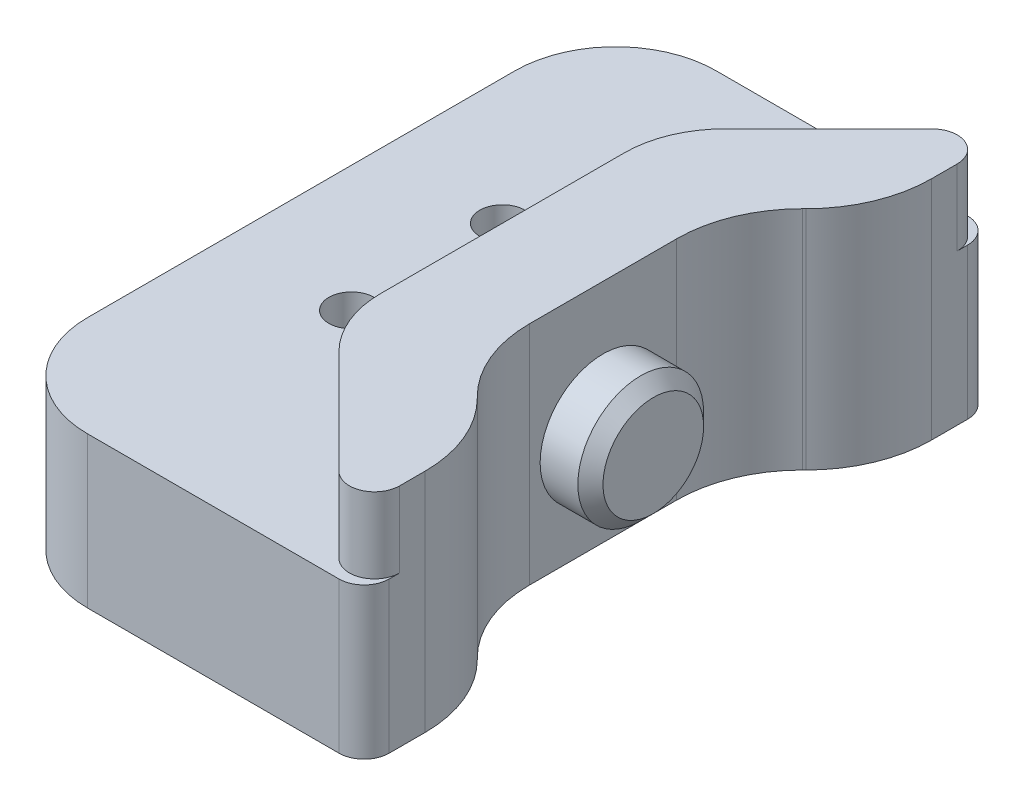
from build123d import *

# Parameters (mm, degrees)
SKETCH_1_R      = 0.9
EXTRUDE_1_DEPTH = 6
EXTRUDE_2_DEPTH = 3
FILLET_2_R      = 4
FILLET_3_R      = 1
SKETCH_3_R      = 2.5
EXTRUDE_3_DEPTH = 2
FILLET_4_R      = 5
CHAMFER_1_SIZE  = 0.5


with BuildPart() as part:
    # 草图1 → 凸台-拉伸1 (new body)
    with BuildSketch(Plane(origin=(0, 0, 0), x_dir=(1, 0, 0), z_dir=(0, 1, 0))):
        Polygon((0, 12.5), (0, -12.5), (15, -12.5), (15, -8), (12, -5), (12, 5), (15, 8), (15, 12.5), align=None)
        with Locations(Location((5, 3, 0), (0, 0, 270))):
            Circle(SKETCH_1_R, mode=Mode.SUBTRACT)
        with Locations(Location((5, -3, 0), (0, 0, 270))):
            Circle(SKETCH_1_R, mode=Mode.SUBTRACT)
    extrude(amount=EXTRUDE_1_DEPTH)

    # 草图2 → 凸台-拉伸2 (add)
    with BuildSketch(Plane(origin=(0, 6, 0), x_dir=(1, 0, 0), z_dir=(0, 1, 0))):
        with BuildLine():
            Line((13.292893219, 11.792893219), (8, 6.5))
            Line((8, 6.5), (8, -6.5))
            Line((8, -6.5), (13.292893219, -11.792893219))
            ThreePointArc((13.292893219, -11.792893219), (14.382683432, -12.00966597), (15, -11.085786438))
            Line((15, -11.085786438), (15, -8))
            Line((15, -8), (12, -5))
            Line((12, -5), (12, 5))
            Line((12, 5), (15, 8))
            Line((15, 8), (15, 11.085786438))
            ThreePointArc((15, 11.085786438), (14.382683432, 12.00966597), (13.292893219, 11.792893219))
        make_face()
    extrude(amount=EXTRUDE_2_DEPTH)

    # 圆角2
    fillet_2_edges = [part.edges().sort_by_distance(p)[0] for p in [
        (0, 3, 12.5),
        (0, 3, -12.5),
        (8, 7.5, -6.5),
        (8, 7.5, 6.5),
    ]]
    fillet(fillet_2_edges, radius=FILLET_2_R)

    # 圆角3
    fillet_3_edges = [part.edges().sort_by_distance(p)[0] for p in [
        (15, 3, -12.5),
        (15, 3, 12.5),
    ]]
    fillet(fillet_3_edges, radius=FILLET_3_R)

    # 草图3 → 凸台-拉伸3 (add)
    with BuildSketch(Plane(origin=(12, 0, 0), x_dir=(0, 0, -1), z_dir=(1, 0, 0))):
        with Locations(Location((0, 4, 0), (0, 0, 180))):
            Circle(SKETCH_3_R)
    extrude(amount=EXTRUDE_3_DEPTH)

    # 圆角4
    fillet_4_edges = [part.edges().sort_by_distance(p)[0] for p in [
        (15, 4.5, -8),
        (12, 4.5, -5),
        (12, 4.5, 5),
        (15, 4.5, 8),
    ]]
    fillet(fillet_4_edges, radius=FILLET_4_R)

    # 倒角1
    chamfer_1_edges = [part.edges().sort_by_distance(p)[0] for p in [
        (14, 4, -2.5),
    ]]
    chamfer(chamfer_1_edges, length=CHAMFER_1_SIZE)


solid = part.part
